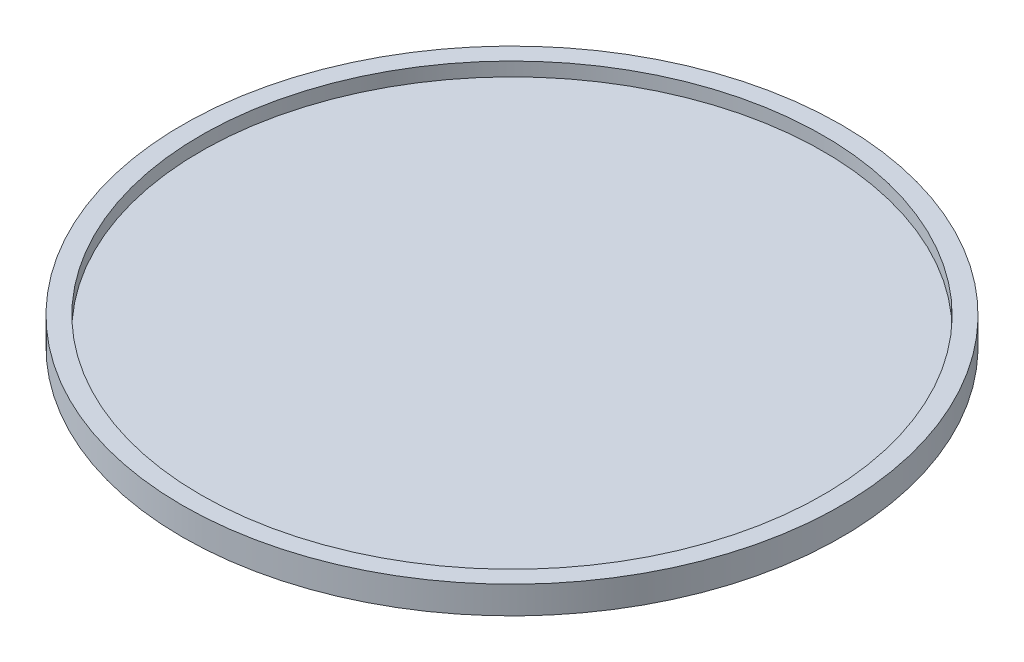
from build123d import *

# Parameters (mm, degrees)
SKETCH1_R           = 18
BOSS_EXTRUDE1_DEPTH = 1.5
SKETCH2_R           = 17
CUT_EXTRUDE1_DEPTH  = 0.75


with BuildPart() as part:
    # Sketch1 → Boss-Extrude1 (new body)
    with BuildSketch(Plane(origin=(0, 0, 0), x_dir=(1, 0, 0), z_dir=(0, 1, 0))):
        with Locations(Location((0, 0, 0), (0, 0, 270))):
            Circle(SKETCH1_R)
    extrude(amount=BOSS_EXTRUDE1_DEPTH)

    # Sketch2 → Cut-Extrude1 (cut)
    with BuildSketch(Plane(origin=(0, 1.5, 0), x_dir=(1, 0, 0), z_dir=(0, 1, 0))):
        with Locations(Location((0, 0, 0), (0, 0, 270))):
            Circle(SKETCH2_R)
    extrude(amount=-CUT_EXTRUDE1_DEPTH, mode=Mode.SUBTRACT)


solid = part.part
